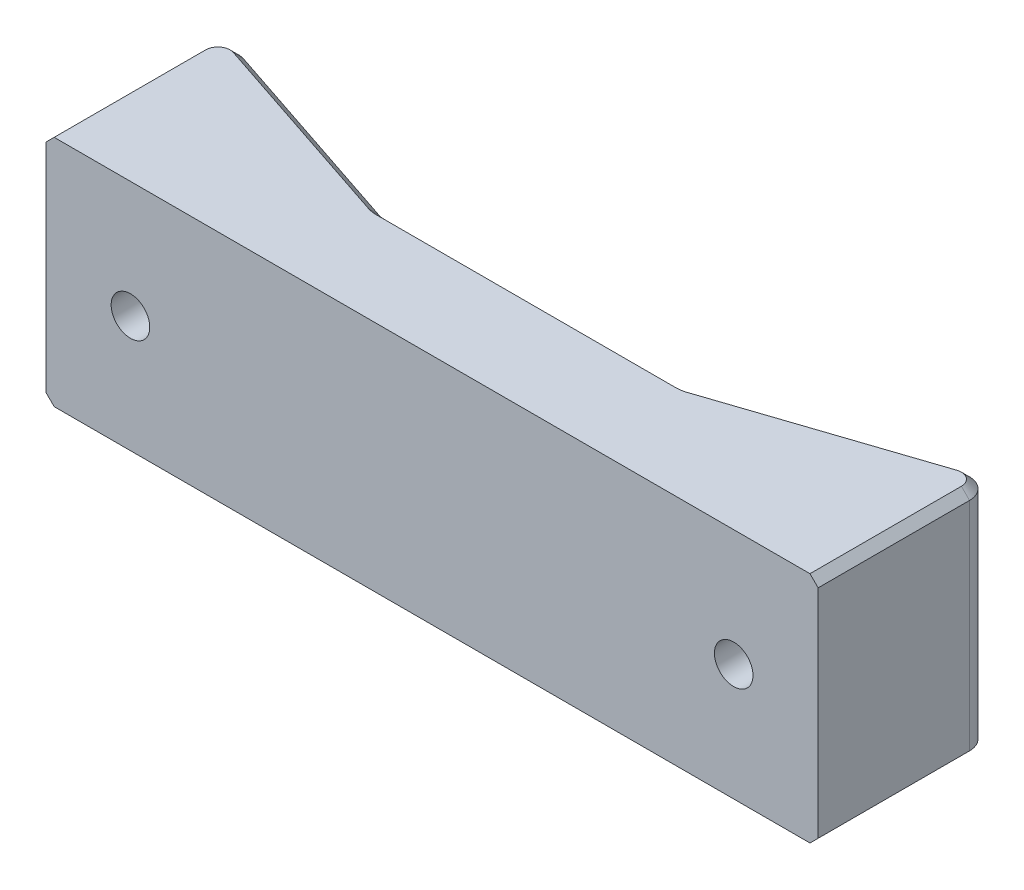
from build123d import *

# Parameters (mm, degrees)
BOSS_EXTRUDE1_DEPTH                            = 14.5
CSK_FOR_M4_FLAT_HEAD_MACHINE_SCREW1_AT_2_COUNT = 2
CSK_FOR_M4_FLAT_HEAD_MACHINE_SCREW1_AT_2_PITCH = 75
FILLET1_R                                      = 2.54
CHAMFER1_SIZE                                  = 1.016


with BuildPart() as part:
    # Sketch1 → Boss-Extrude1 (new, symmetric)
    with BuildSketch(Plane(origin=(0, 0, 0), x_dir=(1, 0, 0), z_dir=(0, 1, 0))):
        Polygon((-48, 0), (48, 0), (48, 22.35), (19.05, 12.7), (-19.05, 12.7), (-48, 22.35), align=None)
    extrude(amount=BOSS_EXTRUDE1_DEPTH, both=True)

    # Sketch5 → CSK for M4 Flat Head Machine Screw1 (revolve, cut)
    with BuildSketch(Plane(origin=(-37.5, 0, -25.4), x_dir=(0, 1, 0), z_dir=(1, 0, 0))):
        Polygon((0, 0), (0, 25.4), (2.4, 25.4), (2.4, 15), (4.7, 12.7), (4.7, 0), align=None)
    csk_for_m4_flat_head_machine_screw1 = revolve(axis=Axis((-37.5, 0, -31.75), (0, 0, 1)), mode=Mode.SUBTRACT)

    # CSK for M4 Flat Head Machine Screw1 at 2: CSK for M4 Flat Head Machine Screw1 ×2
    with Locations(*[(i * CSK_FOR_M4_FLAT_HEAD_MACHINE_SCREW1_AT_2_PITCH, 0, 0) for i in range(1, CSK_FOR_M4_FLAT_HEAD_MACHINE_SCREW1_AT_2_COUNT)]):
        add(csk_for_m4_flat_head_machine_screw1, mode=Mode.SUBTRACT)

    # Fillet1
    fillet1_edges = [part.edges().sort_by_distance(p)[0] for p in [
        (-48, 0, -22.35),
        (-19.05, 0, -12.7),
        (19.05, 0, -12.7),
        (48, 0, -22.35),
    ]]
    fillet(fillet1_edges, radius=FILLET1_R)

    # Chamfer1
    chamfer1_edges = [part.edges().sort_by_distance(p)[0] for p in [
        (48, -14.5, -9.412969124),
        (-48, -14.5, -9.412969124),
        (46.945164123, -14.5, -20.886493398),
        (-46.945164123, -14.5, -20.886493398),
        (32.048907372, -14.5, -17.032969124),
        (-32.048907372, -14.5, -17.032969124),
        (19.04467764, -14.5, -12.732797858),
        (-19.04467764, -14.5, -12.732797858),
        (0, -14.5, -12.7),
        (48, 14.5, -9.412969124),
        (-48, 14.5, -9.412969124),
        (46.945164123, 14.5, -20.886493398),
        (-46.945164123, 14.5, -20.886493398),
        (32.048907372, 14.5, -17.032969124),
        (-32.048907372, 14.5, -17.032969124),
        (19.04467764, 14.5, -12.732797858),
        (-19.04467764, 14.5, -12.732797858),
        (0, 14.5, -12.7),
    ]]
    chamfer(chamfer1_edges, length=CHAMFER1_SIZE)


solid = part.part
